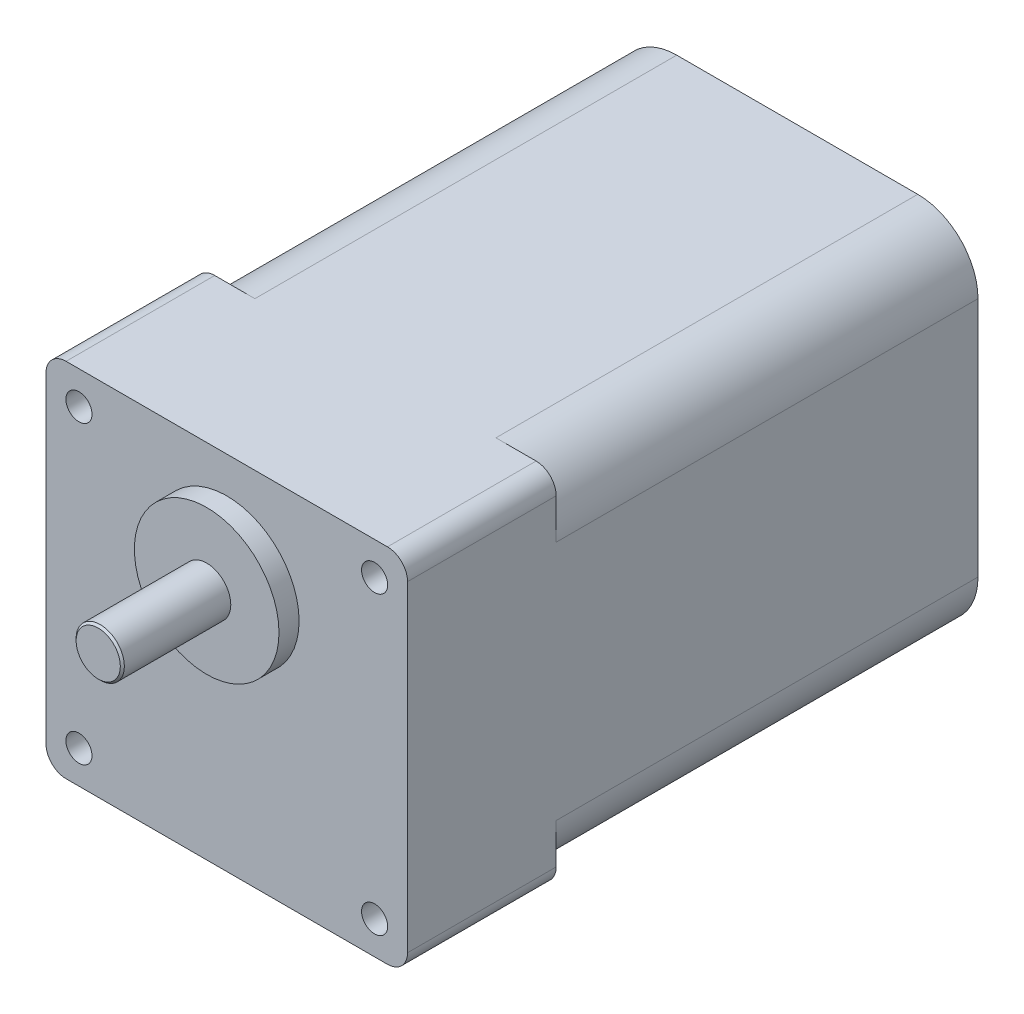
from build123d import *

# Parameters (mm, degrees)
SKETCH1_W           = 90
SKETCH1_H           = 90
BOSS_EXTRUDE1_DEPTH = 37
FILLET1_R           = 5
SKETCH2_R           = 18
BOSS_EXTRUDE2_DEPTH = 5
SKETCH3_R           = 6
BOSS_EXTRUDE3_DEPTH = 27
BOSS_EXTRUDE5_DEPTH = 105
CHAMFER1_SIZE       = 0.5
SKETCH5_R           = 3.25
CUT_EXTRUDE1_DEPTH  = 44.5


with BuildPart() as part:
    # Sketch1 → Boss-Extrude1 (new body)
    with BuildSketch(Plane.XY):
        Rectangle(SKETCH1_W, SKETCH1_H)
    extrude(amount=BOSS_EXTRUDE1_DEPTH)

    # Fillet1
    fillet1_edges = [part.edges().sort_by_distance(p)[0] for p in [
        (45, -45, 18.5),
        (-45, -45, 18.5),
        (-45, 45, 18.5),
        (45, 45, 18.5),
    ]]
    fillet(fillet1_edges, radius=FILLET1_R)

    # Sketch2 → Boss-Extrude2 (add)
    with BuildSketch(Plane.XY.offset(37)):
        with Locations((0, 18)):
            Circle(SKETCH2_R)
    extrude(amount=BOSS_EXTRUDE2_DEPTH)

    # Sketch3 → Boss-Extrude3 (add)
    with BuildSketch(Plane.XY.offset(42)):
        with Locations((0, 18)):
            Circle(SKETCH3_R)
    extrude(amount=BOSS_EXTRUDE3_DEPTH)

    # Sketch4 → Boss-Extrude5 (add)
    with BuildSketch(Plane(origin=(0, 0, 0), x_dir=(-1, 0, 0), z_dir=(0, 0, -1))):
        with BuildLine():
            Line((-30, 45), (30, 45))
            ThreePointArc((30, 45), (40.606601718, 40.606601718), (45, 30))
            Line((45, 30), (45, -30))
            ThreePointArc((45, -30), (40.606601718, -40.606601718), (30, -45))
            Line((30, -45), (-30, -45))
            ThreePointArc((-30, -45), (-40.606601718, -40.606601718), (-45, -30))
            Line((-45, -30), (-45, 30))
            ThreePointArc((-45, 30), (-40.606601718, 40.606601718), (-30, 45))
        make_face()
    extrude(amount=BOSS_EXTRUDE5_DEPTH)

    # Chamfer1
    chamfer1_edges = [part.edges().sort_by_distance(p)[0] for p in [
        (-6, 18, 69),
    ]]
    chamfer(chamfer1_edges, length=CHAMFER1_SIZE)

    # Sketch5 → Cut-Extrude1 (cut)
    with BuildSketch(Plane.XY.offset(37)):
        with Locations((-36.8, 36.8)):
            Circle(SKETCH5_R)
        with Locations((36.8, 36.8)):
            Circle(SKETCH5_R)
        with Locations((36.8, -36.8)):
            Circle(SKETCH5_R)
        with Locations((-36.8, -36.8)):
            Circle(SKETCH5_R)
    extrude(amount=-CUT_EXTRUDE1_DEPTH, mode=Mode.SUBTRACT)


solid = part.part
